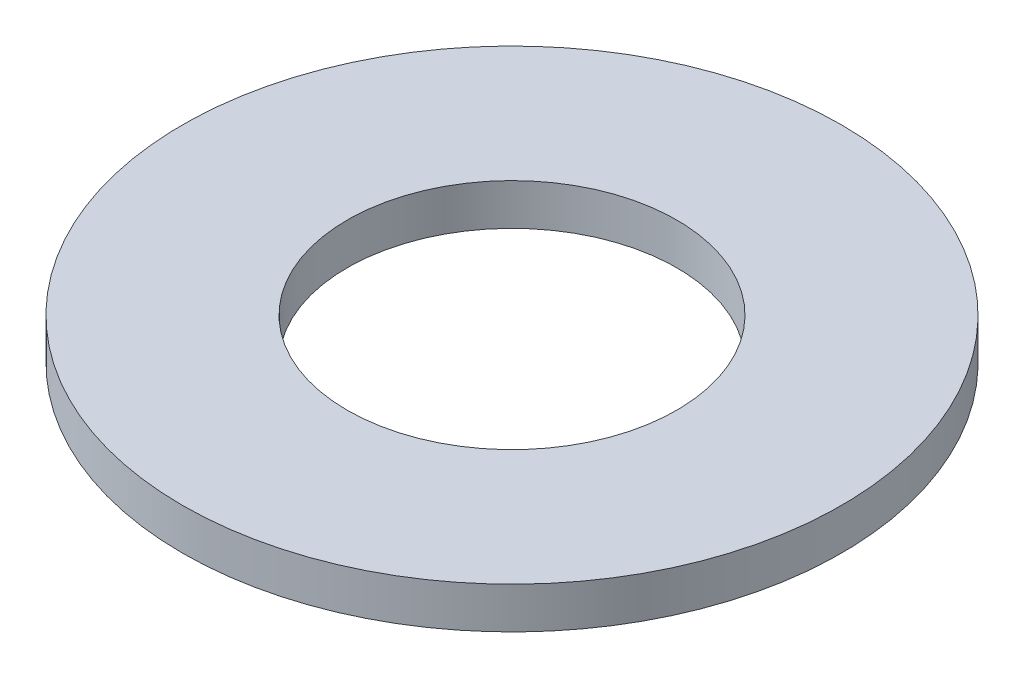
from build123d import *

# Parameters (mm, degrees)
SKETCH1_R           = 10.31875
SKETCH1_R_2         = 5.159375
BOSS_EXTRUDE1_DEPTH = 1.2954


with BuildPart() as part:
    # Sketch1 → Boss-Extrude1 (new body)
    with BuildSketch(Plane(origin=(0, 0, 0), x_dir=(1, 0, 0), z_dir=(0, 1, 0))):
        with Locations(Location((0, 0, 0), (0, 0, 270))):
            Circle(SKETCH1_R)
        with Locations(Location((0, 0, 0), (0, 0, 270))):
            Circle(SKETCH1_R_2, mode=Mode.SUBTRACT)
    extrude(amount=BOSS_EXTRUDE1_DEPTH)


solid = part.part
